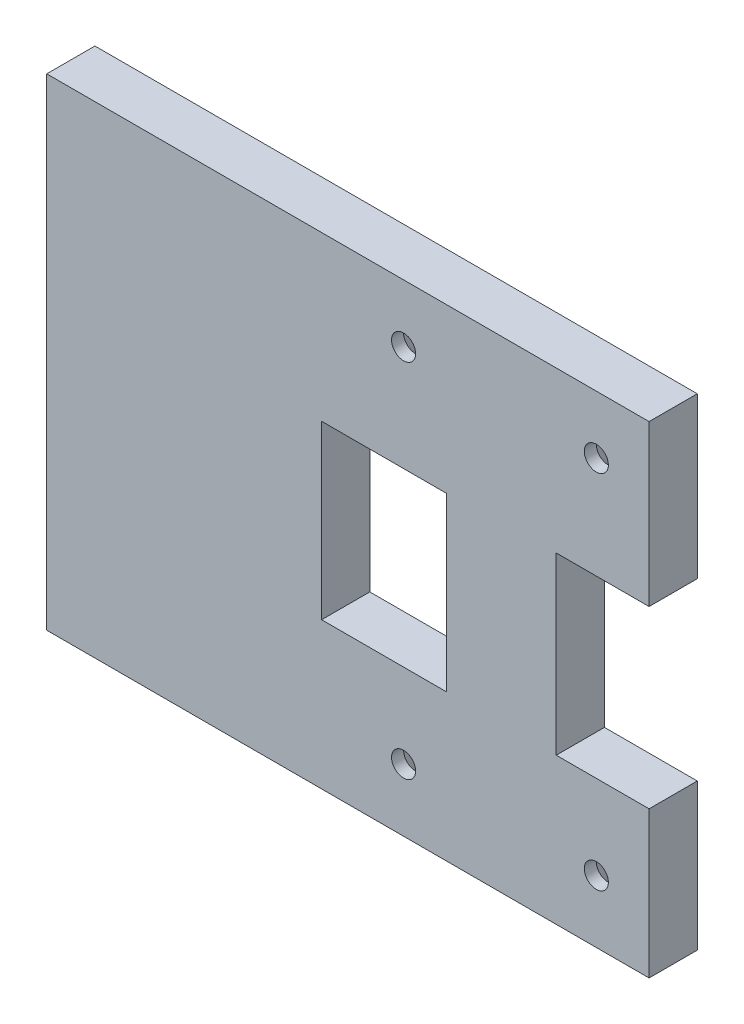
from build123d import *

# Parameters (mm, degrees)
SKETCH1_W                          = 50
SKETCH1_H                          = 40
BOSS_EXTRUDE1_DEPTH                = 4
SKETCH2_W                          = 7.705962758
SKETCH2_H                          = 14.539090136
CUT_EXTRUDE1_DEPTH                 = 122.811546491
SKETCH3_W                          = 10.372123492
SKETCH3_H                          = 14.267331442
CUT_EXTRUDE2_DEPTH                 = 122.811546491
F_2_0_2_DIAMETER_HOLE1_D           = 2
F_2_0_2_DIAMETER_HOLE1_CSINK_D     = 8
F_2_0_2_DIAMETER_HOLE1_CSINK_ANGLE = 90


with BuildPart() as part:
    # Sketch1 → Boss-Extrude1 (new body)
    with BuildSketch(Plane(origin=(0, 0, 34.811611197), x_dir=(-1, 0, 0), z_dir=(0, 0, -1))):
        with Locations((1.46446617, 98.834695645)):
            Rectangle(SKETCH1_W, SKETCH1_H)
    extrude(amount=-BOSS_EXTRUDE1_DEPTH)

    # Sketch2 → Cut-Extrude1 (cut, through all)
    with BuildSketch(Plane.XY.offset(38.811611197)):
        with Locations((19.682552451, 98.267628733)):
            Rectangle(SKETCH2_W, SKETCH2_H)
    extrude(amount=-CUT_EXTRUDE1_DEPTH, mode=Mode.SUBTRACT)

    # Sketch3 → Cut-Extrude2 (cut, through all)
    with BuildSketch(Plane.XY.offset(38.811611197)):
        with Locations((1.539593072, 98.131749386)):
            Rectangle(SKETCH3_W, SKETCH3_H)
    extrude(amount=-CUT_EXTRUDE2_DEPTH, mode=Mode.SUBTRACT)

    # Ø2.0 (2) Diameter Hole1 (through all)
    with Locations(Plane(origin=(0, 0, 34.811611197), x_dir=(-1, 0, 0), z_dir=(0, 0, -1))):
        with Locations((-3.156646479, 84.016340669), (-19.156646479, 84.016340669), (-19.156646479, 114.016340669), (-3.156646479, 114.016340669)):
            CounterSinkHole(F_2_0_2_DIAMETER_HOLE1_D / 2, F_2_0_2_DIAMETER_HOLE1_CSINK_D / 2, counter_sink_angle=F_2_0_2_DIAMETER_HOLE1_CSINK_ANGLE)


solid = part.part
